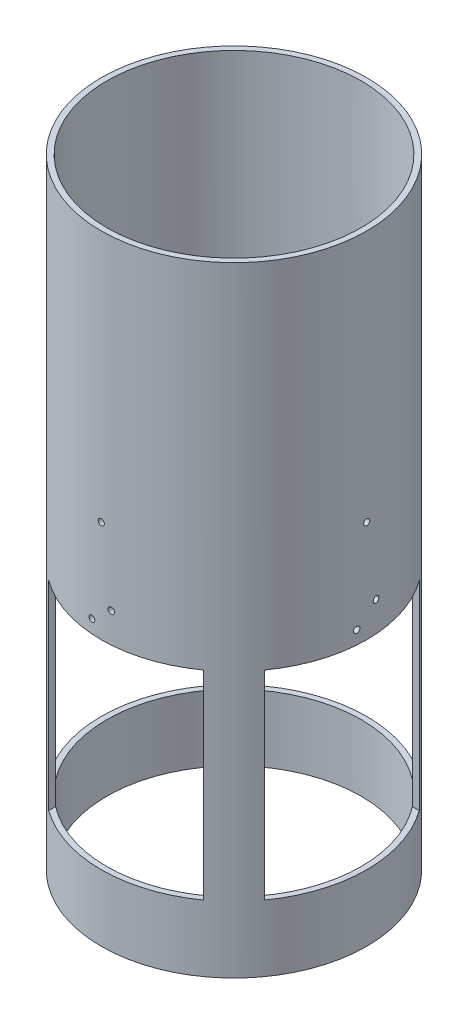
from build123d import *

# Parameters (mm, degrees)
SKETCH1_R           = 76.2
SKETCH1_R_2         = 73.025
BOSS_EXTRUDE1_DEPTH = 330.2
SKETCH6_W           = 88.9
SKETCH6_H           = 114.3
CUT_EXTRUDE6_DEPTH  = 20.574
CIRPATTERN9_COUNT   = 4
SKETCH7_R           = 1.7526
CUT_EXTRUDE7_DEPTH  = 17.78
CIRPATTERN10_COUNT  = 4
BOSS_EXTRUDE2_START = 25.4
SKETCH8_R           = 76.2
SKETCH8_R_2         = 73.025
BOSS_EXTRUDE2_DEPTH = 25.4


with BuildPart() as part:
    # Sketch1 → Boss-Extrude1 (new body)
    with BuildSketch(Plane(origin=(0, 0, 0), x_dir=(1, 0, 0), z_dir=(0, 1, 0))):
        with Locations(Location((0, 0, 0), (0, 0, 270))):
            Circle(SKETCH1_R)
        with Locations(Location((0, 0, 0), (0, 0, 270))):
            Circle(SKETCH1_R_2, mode=Mode.SUBTRACT)
    extrude(amount=BOSS_EXTRUDE1_DEPTH)

    # Sketch6 → Cut-Extrude6 (cut)
    with BuildSketch(Plane(origin=(0, 0, -76.2), x_dir=(-1, 0, 0), z_dir=(0, 0, -1))):
        with Locations((0, 69.85)):
            Rectangle(SKETCH6_W, SKETCH6_H)
    cut_extrude6 = extrude(amount=-CUT_EXTRUDE6_DEPTH, mode=Mode.SUBTRACT)

    # CirPattern9: Cut-Extrude6 ×4 about axis
    cirpattern9_axis = Axis((0, 0, 0), (0, 1, 0))
    for i in range(1, CIRPATTERN9_COUNT):
        add(cut_extrude6.rotate(cirpattern9_axis, i * 360 / CIRPATTERN9_COUNT), mode=Mode.SUBTRACT)

    # Sketch7 → Cut-Extrude7 (cut)
    with BuildSketch(Plane(origin=(0, 0, -76.2), x_dir=(-1, 0, 0), z_dir=(0, 0, -1))):
        with Locations(Location((0, 185.42, 0), (0, 0, 90))):
            Circle(SKETCH7_R)
        with Locations((5.55625, 144.145)):
            Circle(SKETCH7_R)
        with Locations((-5.55625, 134.62)):
            Circle(SKETCH7_R)
    cut_extrude7 = extrude(amount=-CUT_EXTRUDE7_DEPTH, mode=Mode.SUBTRACT)

    # CirPattern10: Cut-Extrude7 ×4 about axis
    cirpattern10_axis = Axis((0, 330.2, 0), (0, 1, 0))
    for i in range(1, CIRPATTERN10_COUNT):
        add(cut_extrude7.rotate(cirpattern10_axis, i * 360 / CIRPATTERN10_COUNT), mode=Mode.SUBTRACT)

    # Sketch8 → Boss-Extrude2 (add)
    with BuildSketch(Plane.XZ.offset(BOSS_EXTRUDE2_START)):
        with Locations(Location((0, 0, 0), (0, 0, 270))):
            Circle(SKETCH8_R)
        with Locations(Location((0, 0, 0), (0, 0, 270))):
            Circle(SKETCH8_R_2, mode=Mode.SUBTRACT)
    extrude(amount=-BOSS_EXTRUDE2_DEPTH)


solid = part.part
